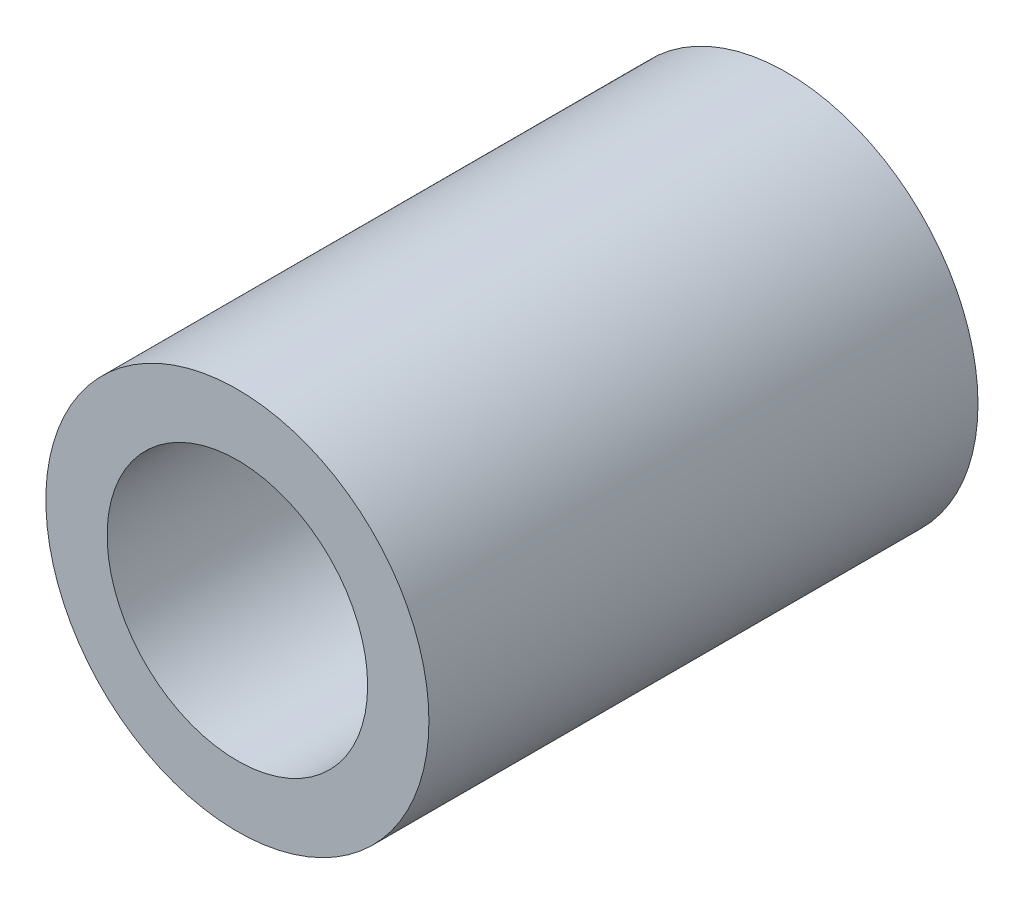
from build123d import *

# Parameters (mm, degrees)
SKETCH_1_R      = 7.5
SKETCH_1_R_2    = 5.1
EXTRUDE_1_DEPTH = 21.5


with BuildPart() as part:
    # 草图1 → 凸台-拉伸1 (new body)
    with BuildSketch(Plane.XY):
        Circle(SKETCH_1_R)
        Circle(SKETCH_1_R_2, mode=Mode.SUBTRACT)
    extrude(amount=EXTRUDE_1_DEPTH)


solid = part.part
